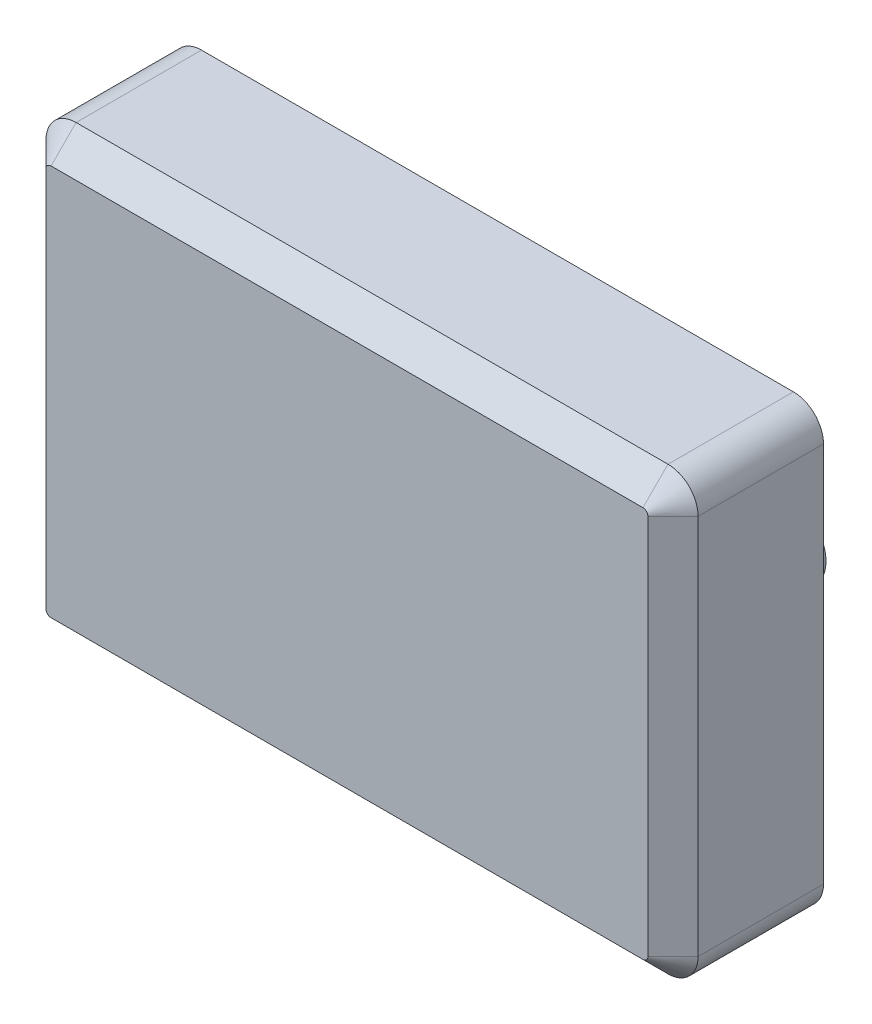
from build123d import *

# Parameters (mm, degrees)
COVER_FEATURE11_13X8_8_R0_6_H1_5_DEPTH    = 3
SKETCH_5_R                                = 0.75
LOCATING_PINS_D1_5_PITCH8_LENGTH1_8_DEPTH = 1.8
CHAMFER_1_SIZE                            = 0.5


with BuildPart() as part:
    # 草图4 → Cover_feature11_13x8.8_R0.6_H1.5 (new body)
    with BuildSketch(Plane.XY):
        with BuildLine():
            Line((-5.9, -4.4), (5.9, -4.4))
            ThreePointArc((5.9, -4.4), (6.324264069, -4.224264069), (6.5, -3.8))
            Line((6.5, -3.8), (6.5, 3.8))
            ThreePointArc((6.5, 3.8), (6.324264069, 4.224264069), (5.9, 4.4))
            Line((5.9, 4.4), (-5.9, 4.4))
            ThreePointArc((-5.9, 4.4), (-6.324264069, 4.224264069), (-6.5, 3.8))
            Line((-6.5, 3.8), (-6.5, -3.8))
            ThreePointArc((-6.5, -3.8), (-6.324264069, -4.224264069), (-5.9, -4.4))
        make_face()
    extrude(amount=COVER_FEATURE11_13X8_8_R0_6_H1_5_DEPTH)

    # 草图5 → Locating_pins_D1.5_pitch8_length1.8 (add)
    with BuildSketch(Plane.XY):
        with Locations((-4, 0)):
            Circle(SKETCH_5_R)
        with Locations((4, 0)):
            Circle(SKETCH_5_R)
    extrude(amount=-LOCATING_PINS_D1_5_PITCH8_LENGTH1_8_DEPTH)

    # 倒角1
    chamfer_1_edges = [part.edges().sort_by_distance(p)[0] for p in [
        (6.324264069, -4.224264069, 3),
        (6.5, 0, 3),
        (6.324264069, 4.224264069, 3),
        (0, 4.4, 3),
        (-6.324264069, 4.224264069, 3),
        (-6.5, 0, 3),
        (-6.324264069, -4.224264069, 3),
        (0, -4.4, 3),
    ]]
    chamfer(chamfer_1_edges, length=CHAMFER_1_SIZE)


solid = part.part
